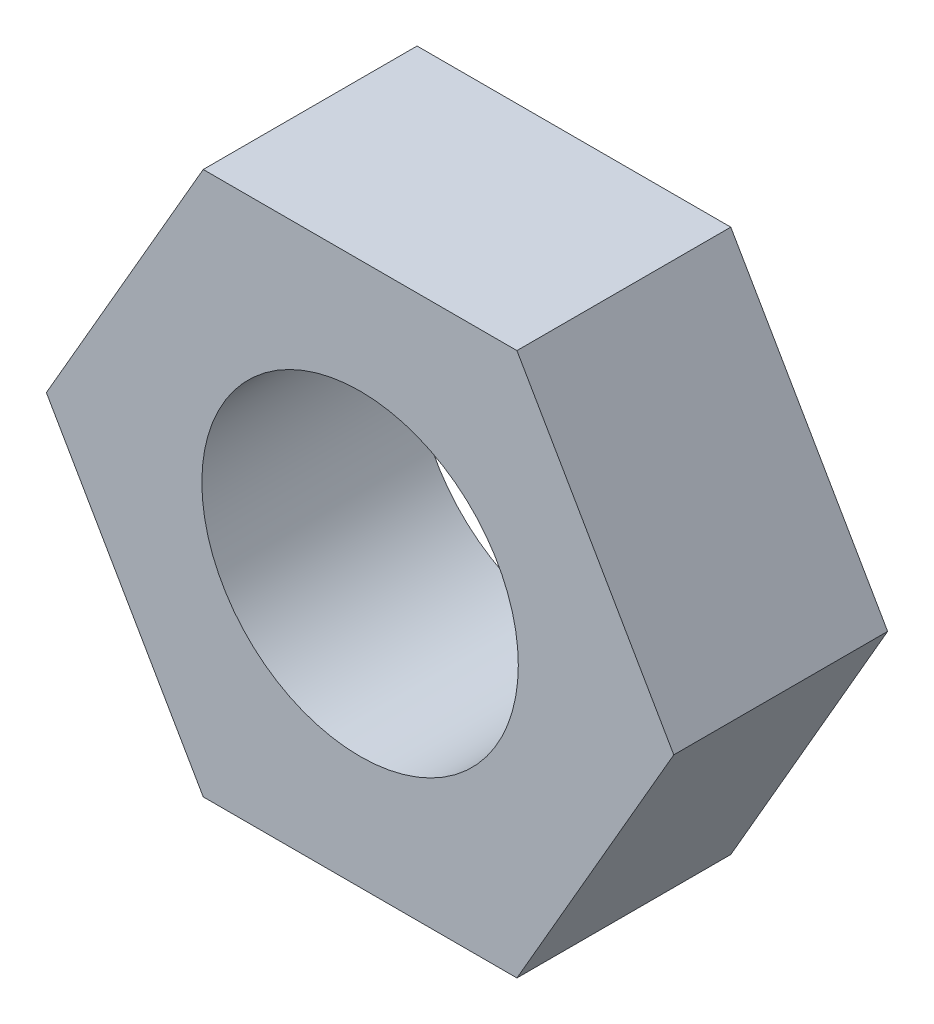
from build123d import *

# Parameters (mm, degrees)
SKETCH1_R           = 2.3495
BOSS_EXTRUDE1_DEPTH = 3.175


with BuildPart() as part:
    # Sketch1 → Boss-Extrude1 (new body)
    with BuildSketch(Plane.XY):
        Polygon((4.657779905, 0), (2.328889953, 4.033755723), (-2.328889953, 4.033755723), (-4.657779905, 0), (-2.328889953, -4.033755723), (2.328889953, -4.033755723), align=None)
        Circle(SKETCH1_R, mode=Mode.SUBTRACT)
    extrude(amount=BOSS_EXTRUDE1_DEPTH)


solid = part.part
